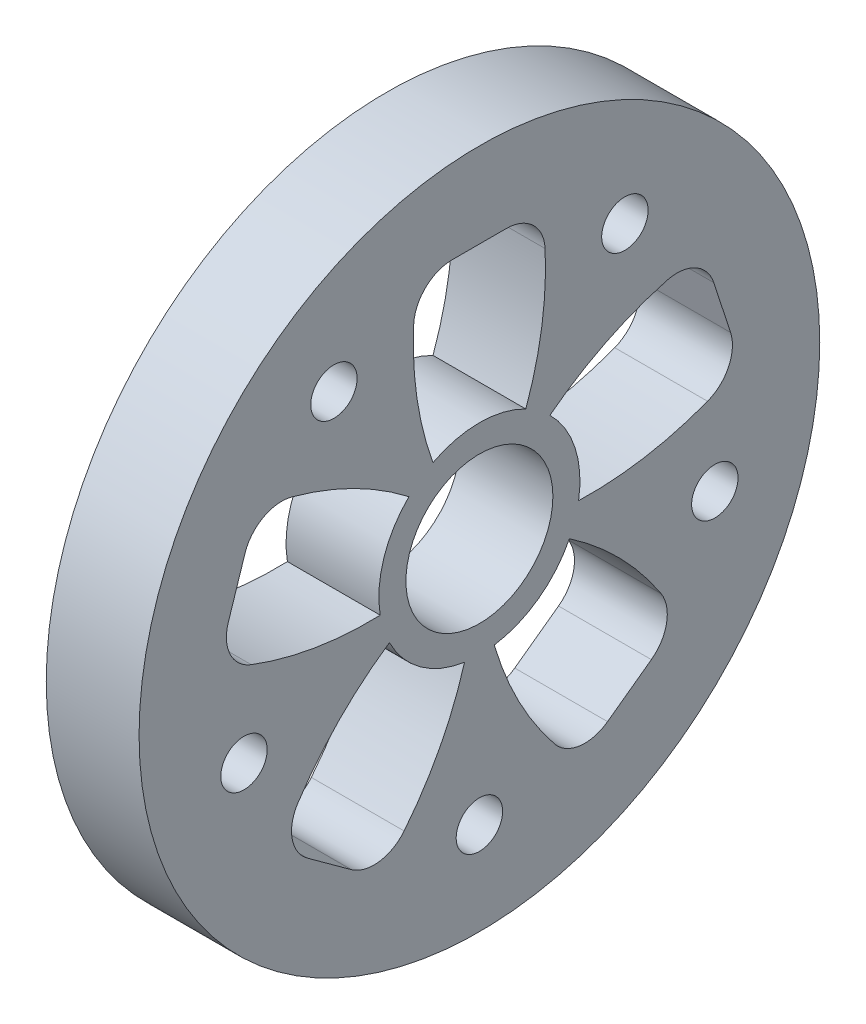
from build123d import *

# Parameters (mm, degrees)
SKETCH_1_R      = 44
SKETCH_1_R_2    = 3
SKETCH_1_R_3    = 9.5
EXTRUDE_1_DEPTH = 12


with BuildPart() as part:
    # 草图1 → 凸台-拉伸1 (new body)
    with BuildSketch(Plane(origin=(0, 0, 0), x_dir=(0, 0, -1), z_dir=(1, 0, 0))):
        Circle(SKETCH_1_R)
        with Locations((0, -32)):
            Circle(SKETCH_1_R_2, mode=Mode.SUBTRACT)
        with Locations((-30.433808521, -9.88854382)):
            Circle(SKETCH_1_R_2, mode=Mode.SUBTRACT)
        with Locations((-18.809128073, 25.88854382)):
            Circle(SKETCH_1_R_2, mode=Mode.SUBTRACT)
        with Locations((18.809128073, 25.88854382)):
            Circle(SKETCH_1_R_2, mode=Mode.SUBTRACT)
        with Locations((30.433808521, -9.88854382)):
            Circle(SKETCH_1_R_2, mode=Mode.SUBTRACT)
        Circle(SKETCH_1_R_3, mode=Mode.SUBTRACT)
        with BuildLine():
            Line((-3.5, 33), (3.5, 33))
            ThreePointArc((3.5, 33), (6.946569358, 31.62231413), (8.493822755, 28.248463863))
            ThreePointArc((8.493822755, 28.248463863), (8.076258868, 19.766783996), (6, 11.532562595))
            ThreePointArc((6, 11.532562595), (0, 13), (-6, 11.532562595))
            ThreePointArc((-6, 11.532562595), (-8.076258868, 19.766783996), (-8.493822755, 28.248463863))
            ThreePointArc((-8.493822755, 28.248463863), (-6.946569358, 31.62231413), (-3.5, 33))
        make_face(mode=Mode.SUBTRACT)
        with BuildLine():
            Line((30.303305557, 13.526258621), (32.466424518, 6.868863007))
            ThreePointArc((32.466424518, 6.868863007), (32.221215898, 3.165252414), (29.490621211, 0.651149919))
            ThreePointArc((29.490621211, 0.651149919), (21.295029967, -1.572706445), (12.822220771, -2.142581267))
            ThreePointArc((12.822220771, -2.142581267), (12.363734712, 4.017220927), (9.114016839, 9.270096928))
            ThreePointArc((9.114016839, 9.270096928), (16.303627484, 13.789250803), (24.241150054, 16.807360878))
            ThreePointArc((24.241150054, 16.807360878), (27.92799993, 16.378412522), (30.303305557, 13.526258621))
        make_face(mode=Mode.SUBTRACT)
        with BuildLine():
            Line((22.228472806, -24.640312431), (16.565353845, -28.754809197))
            ThreePointArc((16.565353845, -28.754809197), (12.967237226, -29.666080556), (9.732383503, -27.846031081))
            ThreePointArc((9.732383503, -27.846031081), (5.084793443, -20.738770033), (1.924568248, -12.856750642))
            ThreePointArc((1.924568248, -12.856750642), (7.64120828, -10.517220927), (11.632772181, -5.803327614))
            ThreePointArc((11.632772181, -5.803327614), (18.152454794, -11.24455832), (23.475677415, -17.860943579))
            ThreePointArc((23.475677415, -17.860943579), (24.207022553, -21.49989851), (22.228472806, -24.640312431))
        make_face(mode=Mode.SUBTRACT)
        with BuildLine():
            Line((-16.565353845, -28.754809197), (-22.228472806, -24.640312431))
            ThreePointArc((-22.228472806, -24.640312431), (-24.207022553, -21.49989851), (-23.475677415, -17.860943579))
            ThreePointArc((-23.475677415, -17.860943579), (-18.152454794, -11.24455832), (-11.632772181, -5.803327614))
            ThreePointArc((-11.632772181, -5.803327614), (-7.64120828, -10.517220927), (-1.924568248, -12.856750642))
            ThreePointArc((-1.924568248, -12.856750642), (-5.084793443, -20.738770033), (-9.732383503, -27.846031081))
            ThreePointArc((-9.732383503, -27.846031081), (-12.967237226, -29.666080556), (-16.565353845, -28.754809197))
        make_face(mode=Mode.SUBTRACT)
        with BuildLine():
            Line((-32.466424518, 6.868863007), (-30.303305557, 13.526258621))
            ThreePointArc((-30.303305557, 13.526258621), (-27.92799993, 16.378412522), (-24.241150054, 16.807360878))
            ThreePointArc((-24.241150054, 16.807360878), (-16.303627484, 13.789250803), (-9.114016839, 9.270096928))
            ThreePointArc((-9.114016839, 9.270096928), (-12.363734712, 4.017220927), (-12.822220771, -2.142581267))
            ThreePointArc((-12.822220771, -2.142581267), (-21.295029967, -1.572706445), (-29.490621211, 0.651149919))
            ThreePointArc((-29.490621211, 0.651149919), (-32.221215898, 3.165252414), (-32.466424518, 6.868863007))
        make_face(mode=Mode.SUBTRACT)
    extrude(amount=EXTRUDE_1_DEPTH)


solid = part.part
